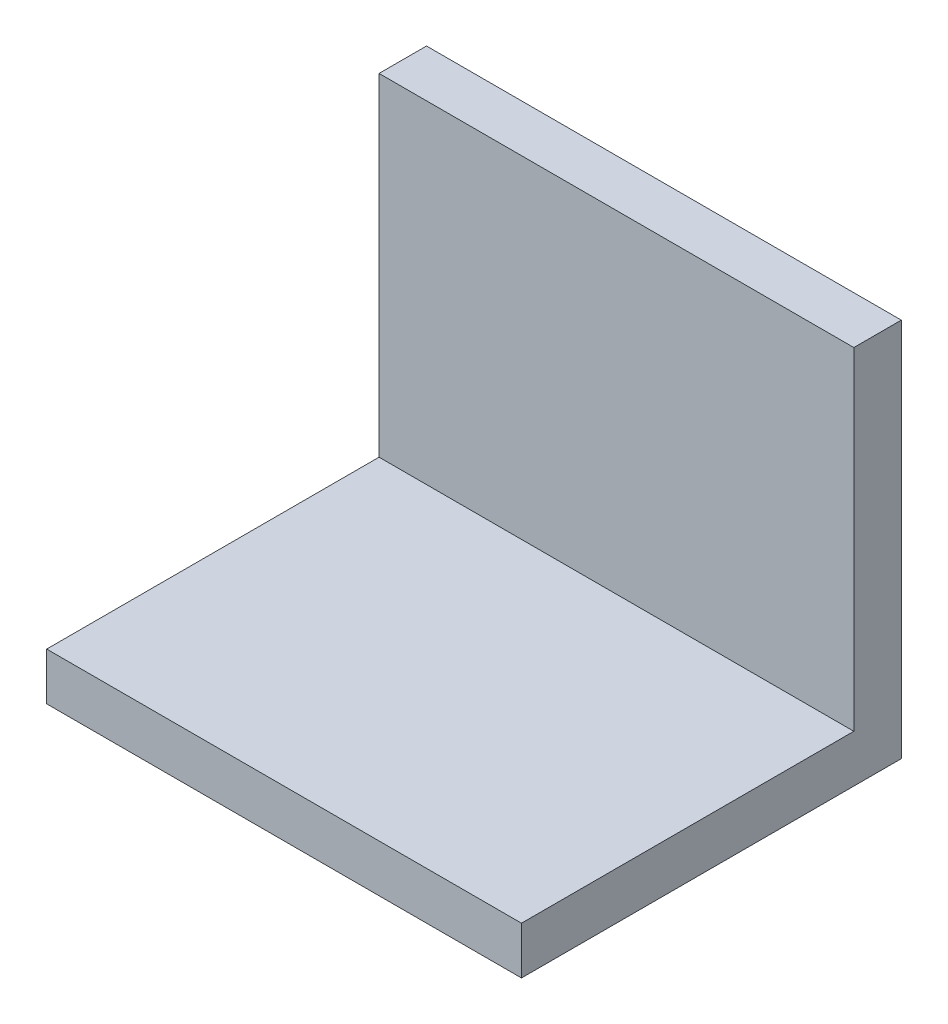
from build123d import *

# Parameters (mm, degrees)
EXTRUDE_1_DEPTH = 50


with BuildPart() as part:
    # 스케치1 → 보스-돌출1 (new body)
    with BuildSketch(Plane(origin=(0, 0, 0), x_dir=(0, 0, -1), z_dir=(1, 0, 0))):
        Polygon((0, 0), (40, 0), (40, 40), (35, 40), (35, 5), (0, 5), align=None)
    extrude(amount=EXTRUDE_1_DEPTH)


solid = part.part
